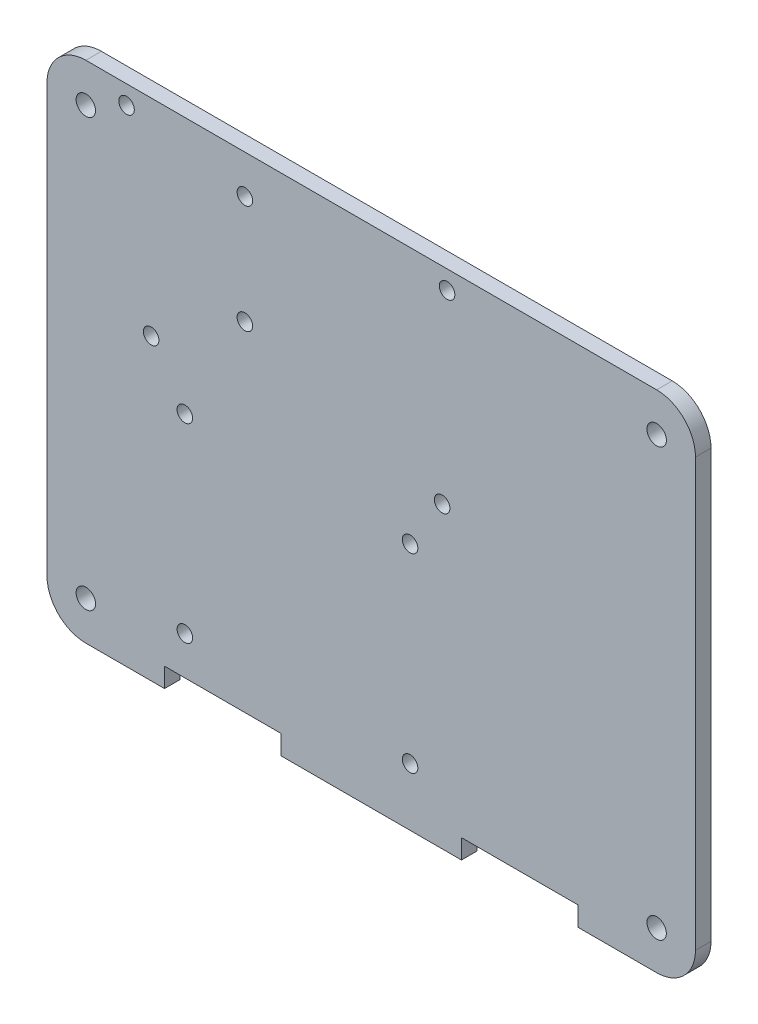
from build123d import *

# Parameters (mm, degrees)
SKETCH1_W           = 167
SKETCH1_H           = 130
BOSS_EXTRUDE1_DEPTH = 4
FILLET1_R           = 10
FILLET2_R           = 10
SKETCH5_R           = 2.5
CUT_EXTRUDE4_DEPTH  = 70
SKETCH6_W           = 30
SKETCH6_H           = 5
CUT_EXTRUDE5_DEPTH  = 10
SKETCH10_R          = 2
CUT_EXTRUDE9_DEPTH  = 106.892634305
SKETCH11_R          = 2
CUT_EXTRUDE10_DEPTH = 106.892634305


with BuildPart() as part:
    # Sketch1 → Boss-Extrude1 (new body)
    with BuildSketch(Plane.XY):
        Rectangle(SKETCH1_W, SKETCH1_H)
    extrude(amount=BOSS_EXTRUDE1_DEPTH)

    # Fillet1
    fillet1_edges = [part.edges().sort_by_distance(p)[0] for p in [
        (-83.5, -65, 2),
        (-83.5, 65, 2),
    ]]
    fillet(fillet1_edges, radius=FILLET1_R)

    # Fillet2
    fillet2_edges = [part.edges().sort_by_distance(p)[0] for p in [
        (83.5, -65, 2),
        (83.5, 65, 2),
    ]]
    fillet(fillet2_edges, radius=FILLET2_R)

    # Sketch5 → Cut-Extrude4 (cut)
    with BuildSketch(Plane.XY.offset(4)):
        with Locations((-73.5, 55)):
            Circle(SKETCH5_R)
        with Locations((73.5, 55)):
            Circle(SKETCH5_R)
        with Locations((-73.5, -55)):
            Circle(SKETCH5_R)
        with Locations((73.5, -55)):
            Circle(SKETCH5_R)
    extrude(amount=-CUT_EXTRUDE4_DEPTH, mode=Mode.SUBTRACT)

    # Sketch6 → Cut-Extrude5 (cut)
    with BuildSketch(Plane.XY.offset(4)):
        with Locations((-38.233797414, -62.5)):
            Rectangle(SKETCH6_W, SKETCH6_H)
        with Locations((38.233797414, -62.5)):
            Rectangle(SKETCH6_W, SKETCH6_H)
    extrude(amount=-CUT_EXTRUDE5_DEPTH, mode=Mode.SUBTRACT)

    # Sketch10 → Cut-Extrude9 (cut, through all)
    with BuildSketch(Plane.XY.offset(4)):
        with Locations((-48, -1.106245372)):
            Circle(SKETCH10_R)
        with Locations((10, -50.106245372)):
            Circle(SKETCH10_R)
        with Locations((-48, -50.106245372)):
            Circle(SKETCH10_R)
        with Locations((10, -1.106245372)):
            Circle(SKETCH10_R)
    extrude(amount=-CUT_EXTRUDE9_DEPTH, mode=Mode.SUBTRACT)

    # Sketch11 → Cut-Extrude10 (cut, through all)
    with BuildSketch(Plane.XY.offset(4)):
        with Locations((-63.02, 60.190179321)):
            Circle(SKETCH11_R)
        with Locations((-32.54, 55.110179321)):
            Circle(SKETCH11_R)
        with Locations((-32.54, 27.170179321)):
            Circle(SKETCH11_R)
        with Locations((19.53, 60.190179321)):
            Circle(SKETCH11_R)
        with Locations((18.26, 11.930179321)):
            Circle(SKETCH11_R)
        with Locations((-56.67, 11.930179321)):
            Circle(SKETCH11_R)
    extrude(amount=-CUT_EXTRUDE10_DEPTH, mode=Mode.SUBTRACT)


solid = part.part
